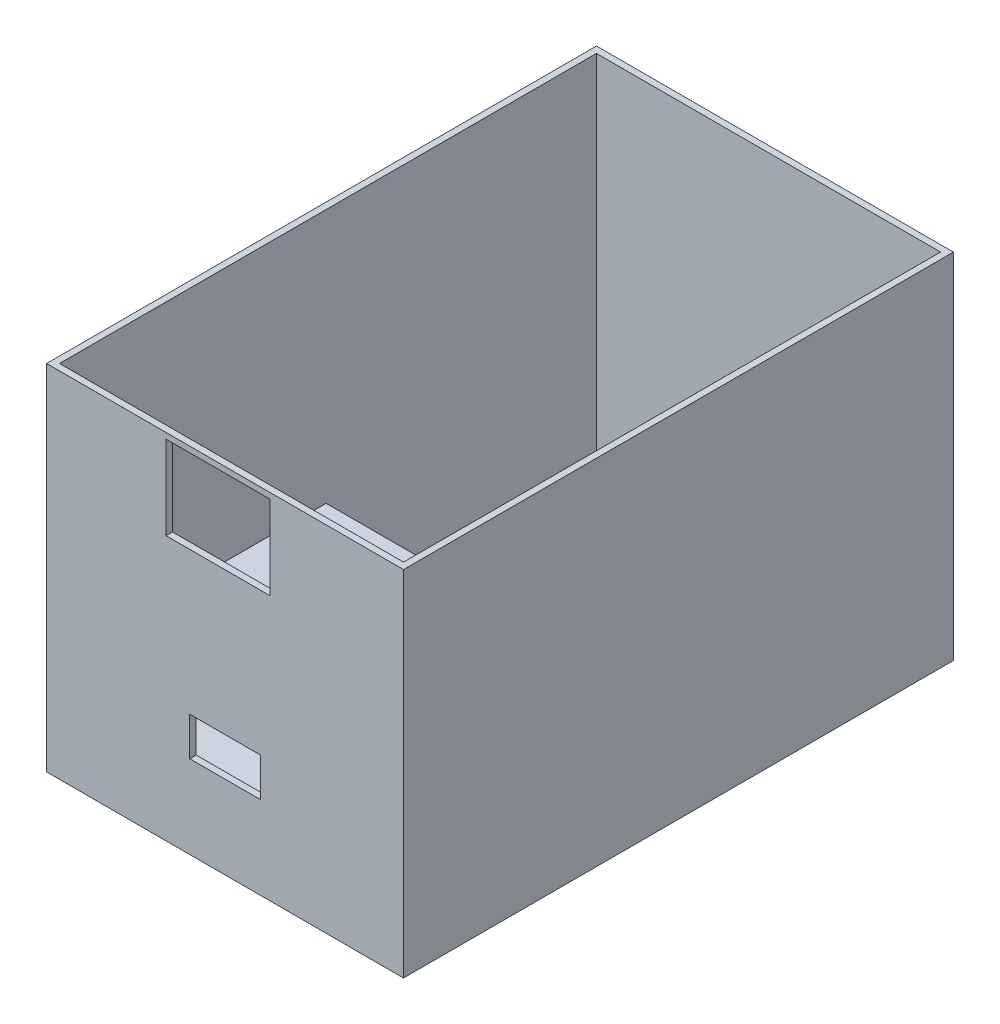
from build123d import *

# Parameters (mm, degrees)
SKETCH1_W           = 55.5
SKETCH1_H           = 85.5
SKETCH1_W_2         = 53.5
SKETCH1_H_2         = 83.5
BOSS_EXTRUDE1_DEPTH = 54
SKETCH2_W           = 55.5
SKETCH2_H           = 85.5
BOSS_EXTRUDE2_DEPTH = 1
SKETCH3_W           = 11
SKETCH3_H           = 6
CUT_EXTRUDE1_DEPTH  = 1
SKETCH5_W           = 30
SKETCH5_H           = 5
BOSS_EXTRUDE4_DEPTH = 30
SKETCH8_W           = 16.2
SKETCH8_H           = 13
CUT_EXTRUDE3_DEPTH  = 1


with BuildPart() as part:
    # Sketch1 → Boss-Extrude1 (new body)
    with BuildSketch(Plane(origin=(0, 0, 0), x_dir=(1, 0, 0), z_dir=(0, 1, 0))):
        Rectangle(SKETCH1_W, SKETCH1_H)
        Rectangle(SKETCH1_W_2, SKETCH1_H_2, mode=Mode.SUBTRACT)
    extrude(amount=BOSS_EXTRUDE1_DEPTH)

    # Sketch2 → Boss-Extrude2 (add)
    with BuildSketch(Plane.XZ):
        Rectangle(SKETCH2_W, SKETCH2_H)
    extrude(amount=BOSS_EXTRUDE2_DEPTH)

    # Sketch3 → Cut-Extrude1 (cut)
    with BuildSketch(Plane.XY.offset(42.75)):
        with Locations((0, 14.9)):
            Rectangle(SKETCH3_W, SKETCH3_H)
    extrude(amount=-CUT_EXTRUDE1_DEPTH, mode=Mode.SUBTRACT)

    # Sketch5 → Boss-Extrude4 (add)
    with BuildSketch(Plane(origin=(0, 0, 41.75), x_dir=(-1, 0, 0), z_dir=(0, 0, -1))):
        with Locations((0.286122551, 23.4)):
            Rectangle(SKETCH5_W, SKETCH5_H)
    extrude(amount=BOSS_EXTRUDE4_DEPTH)

    # Sketch8 → Cut-Extrude3 (cut)
    with BuildSketch(Plane(origin=(0, 0, 41.75), x_dir=(-1, 0, 0), z_dir=(0, 0, -1))):
        with Locations((1.080339393, 46.6)):
            Rectangle(SKETCH8_W, SKETCH8_H)
    extrude(amount=-CUT_EXTRUDE3_DEPTH, mode=Mode.SUBTRACT)


solid = part.part
